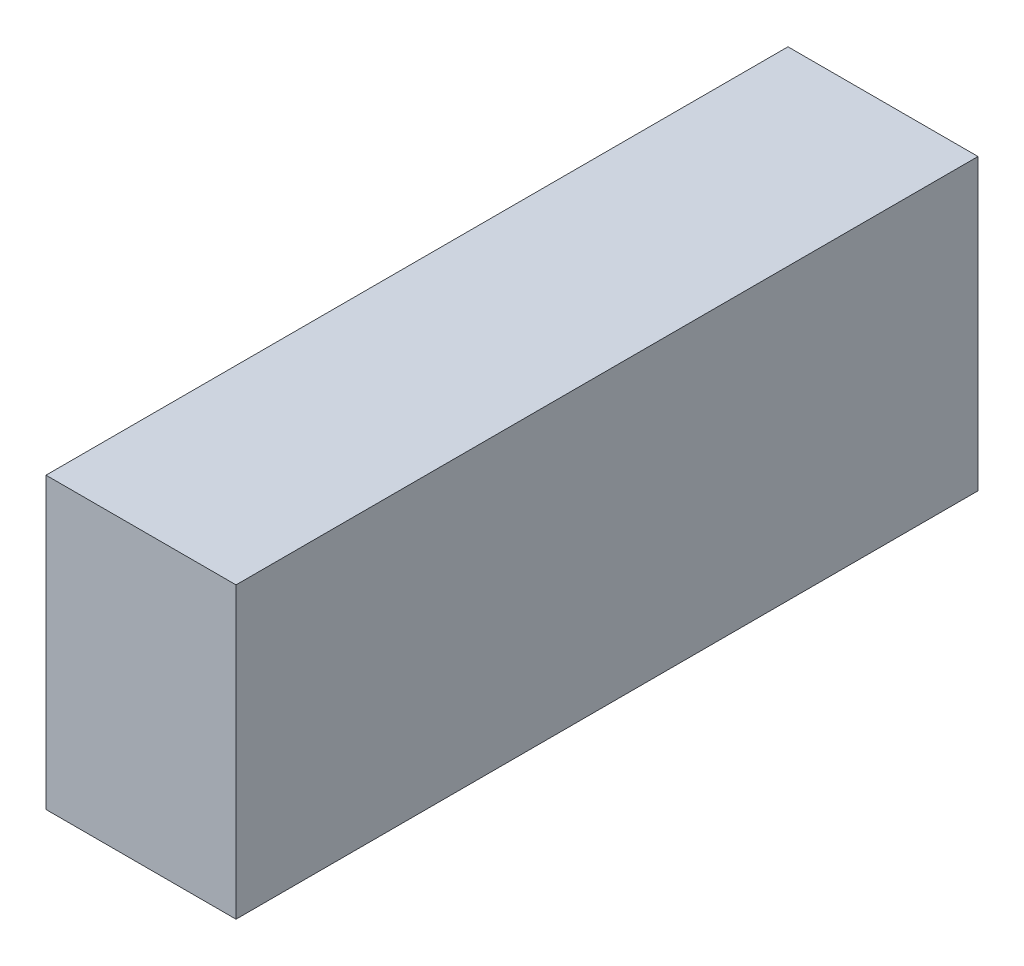
from build123d import *

# Parameters (mm, degrees)
SKETCH1_W           = 42
SKETCH1_H           = 64
BOSS_EXTRUDE1_DEPTH = 164


with BuildPart() as part:
    # Sketch1 → Boss-Extrude1 (new body)
    with BuildSketch(Plane.XY):
        Rectangle(SKETCH1_W, SKETCH1_H)
    extrude(amount=BOSS_EXTRUDE1_DEPTH)


solid = part.part
